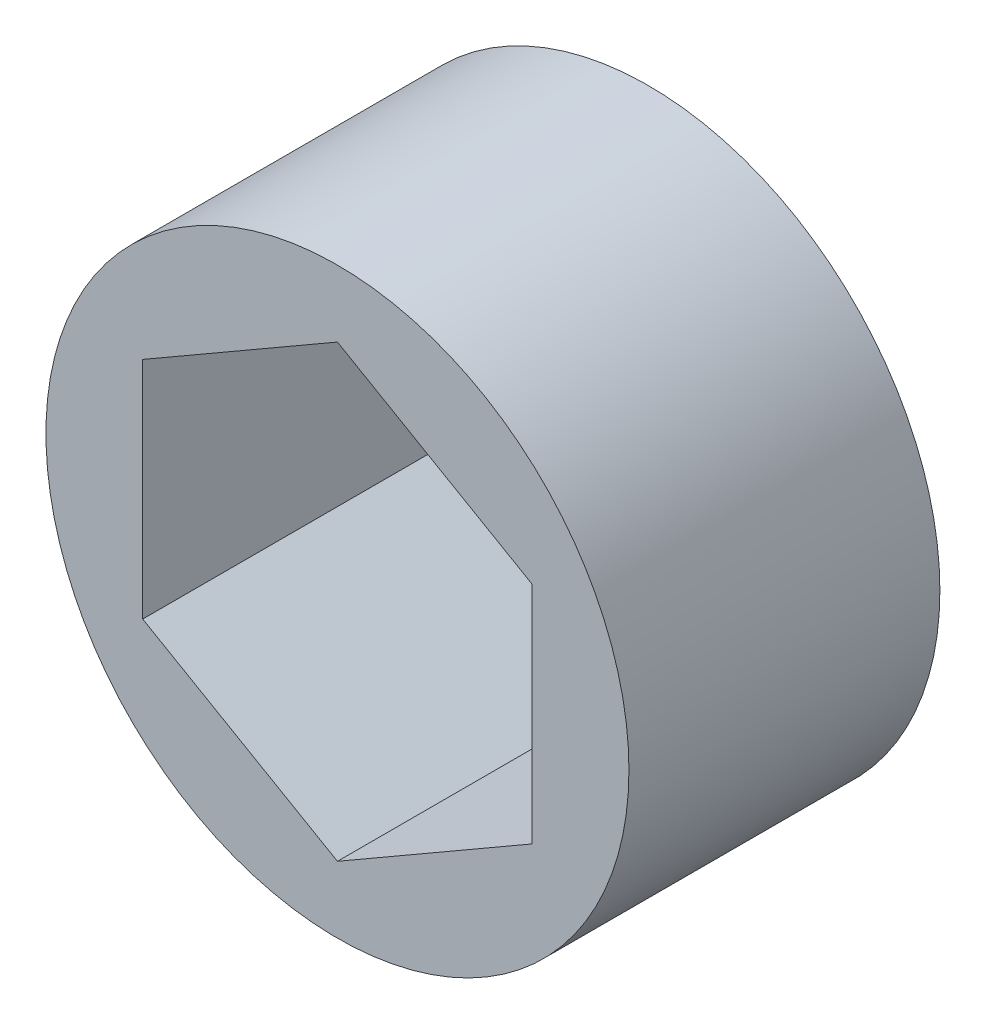
from build123d import *

# Parameters (mm, degrees)
SKETCH1_R           = 9.525
BOSS_EXTRUDE1_DEPTH = 5.08


with BuildPart() as part:
    # Sketch1 → Boss-Extrude1 (new, symmetric)
    with BuildSketch(Plane.XY):
        Circle(SKETCH1_R)
        Polygon((6.3627, 3.673506558), (0, 7.347013116), (-6.3627, 3.673506558), (-6.3627, -3.673506558), (0, -7.347013116), (6.3627, -3.673506558), align=None, mode=Mode.SUBTRACT)
    extrude(amount=BOSS_EXTRUDE1_DEPTH, both=True)


solid = part.part
